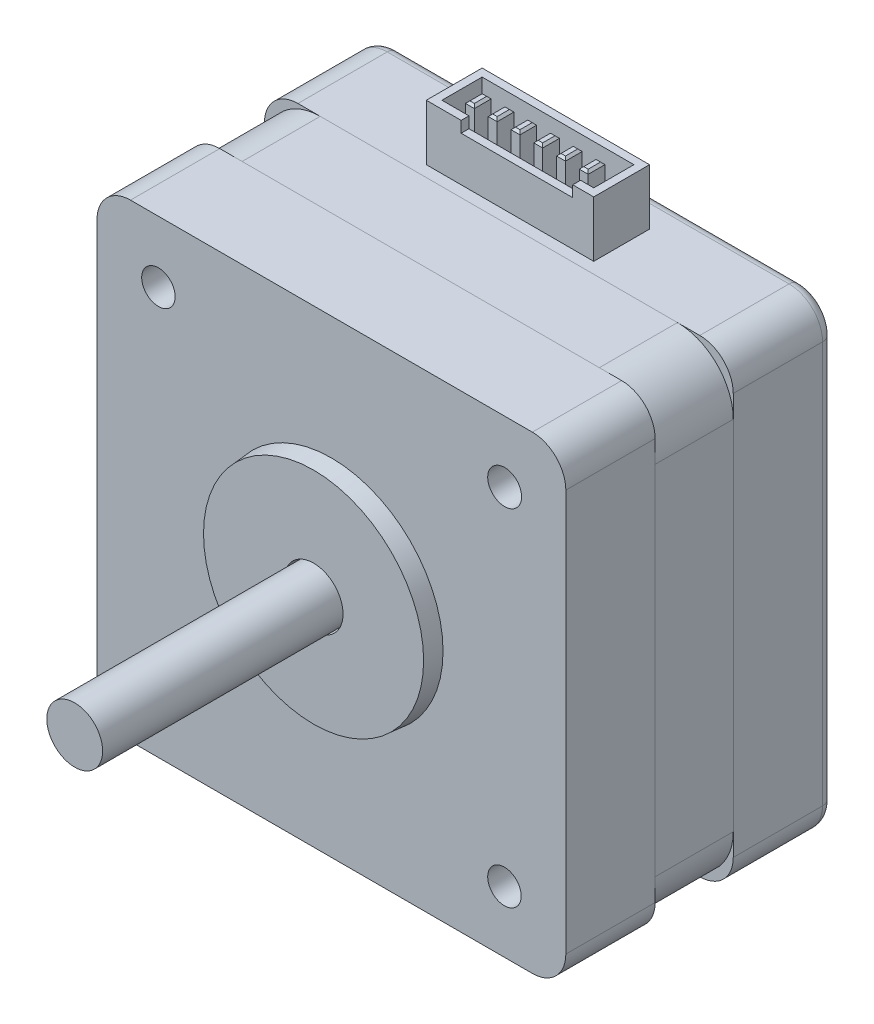
from build123d import *

# Parameters (mm, degrees)
SKETCH_1_R          = 1.5
EXTRUDE_1_DEPTH     = 8
SKETCH_4_R          = 2.5
EXTRUDE_2_DEPTH     = 23
SKETCH_9_W          = 42
SKETCH_9_H          = 42
EXTRUDE_7_DEPTH     = 7
SKETCH_10_W         = 42
SKETCH_10_H         = 42
EXTRUDE_8_DEPTH     = 9
FILLET_1_R          = 3
FILLET_2_R          = 5
SKETCH_12_R         = 1.5
SKETCH_12_R_2       = 1.518540069
CUT_EXTRUDE_1_DEPTH = 39.183766184
SKETCH_14_W         = 15
SKETCH_14_H         = 5
SKETCH_14_W_2       = 13.6
SKETCH_14_H_2       = 3.6
SKETCH_14_W_3       = 0.8
SKETCH_14_H_3       = 1.5
EXTRUDE_10_DEPTH    = 5
CHAMFER_1_SIZE      = 0.2
SKETCH_15_W         = 10
SKETCH_15_H         = 1
CUT_EXTRUDE_2_DEPTH = 0.7
FILLET_3_R          = 1
SKETCH_16_R         = 10
SKETCH_16_R_2       = 2.5
EXTRUDE_11_DEPTH    = 1.6
EXTRUDE_11_DRAFT    = 5
SKETCH_18_R         = 5
CUT_EXTRUDE_3_DEPTH = 3
EXTRUDE_START       = 2
SKETCH_19_R         = 2.5
EXTRUDE_13_DEPTH    = 2


with BuildPart() as part:
    # 草图1 → 凸台-拉伸1 (new body)
    with BuildSketch(Plane.XY):
        with BuildLine():
            Line((-18, 21), (18, 21))
            ThreePointArc((18, 21), (20.121320344, 20.121320344), (21, 18))
            Line((21, 18), (21, -18))
            ThreePointArc((21, -18), (20.121320344, -20.121320344), (18, -21))
            Line((18, -21), (-18, -21))
            ThreePointArc((-18, -21), (-20.121320344, -20.121320344), (-21, -18))
            Line((-21, -18), (-21, 18))
            ThreePointArc((-21, 18), (-20.121320344, 20.121320344), (-18, 21))
        make_face()
        with Locations((-15.5, 15.5)):
            Circle(SKETCH_1_R, mode=Mode.SUBTRACT)
        with Locations(Location((15.5, 15.5, 0), (0, 0, 180))):
            Circle(SKETCH_1_R, mode=Mode.SUBTRACT)
        with Locations((15.5, -15.5)):
            Circle(SKETCH_1_R, mode=Mode.SUBTRACT)
        with Locations(Location((-15.5, -15.5, 0), (0, 0, 180))):
            Circle(SKETCH_1_R, mode=Mode.SUBTRACT)
    extrude(amount=EXTRUDE_1_DEPTH)

    # 草图4 → 凸台-拉伸2 (add)
    with BuildSketch(Plane.XY.offset(8)):
        with Locations(Location((0, 0, 0), (0, 0, 180))):
            Circle(SKETCH_4_R)
    extrude(amount=EXTRUDE_2_DEPTH)


with BuildPart() as body_2:
    # 草图9 → 凸台-拉伸7 (new body)
    with BuildSketch(Plane(origin=(0, 0, 0), x_dir=(-1, 0, 0), z_dir=(0, 0, -1))):
        Rectangle(SKETCH_9_W, SKETCH_9_H)
    extrude(amount=EXTRUDE_7_DEPTH)

    # 圆角2
    fillet_2_edges = [body_2.edges().sort_by_distance(p)[0] for p in [
        (-21, -21, -3.5),
        (21, -21, -3.5),
        (21, 21, -3.5),
        (-21, 21, -3.5),
    ]]
    fillet(fillet_2_edges, radius=FILLET_2_R)


with BuildPart() as body_3:
    # 草图10 → 凸台-拉伸8 (new body)
    with BuildSketch(Plane(origin=(0, 0, -7), x_dir=(-1, 0, 0), z_dir=(0, 0, -1))):
        Rectangle(SKETCH_10_W, SKETCH_10_H)
    extrude(amount=EXTRUDE_8_DEPTH)

    # 圆角1
    fillet_1_edges = [body_3.edges().sort_by_distance(p)[0] for p in [
        (21, 21, -11.5),
        (-21, 21, -11.5),
        (-21, -21, -11.5),
        (21, -21, -11.5),
    ]]
    fillet(fillet_1_edges, radius=FILLET_1_R)


with BuildPart() as cut_extrude_1_tool:
    # 草图12 → 切除-拉伸1 (new, through all)
    with BuildSketch(Plane.XY.offset(8)):
        with Locations((-15.5, 15.5)):
            Circle(SKETCH_12_R)
        with Locations((15.518540069, 15.5)):
            Circle(SKETCH_12_R_2)
        with Locations((-15.5, -15.5)):
            Circle(SKETCH_12_R)
        with Locations((15.5, -15.5)):
            Circle(SKETCH_12_R)
    extrude(amount=-CUT_EXTRUDE_1_DEPTH)


with BuildPart() as part_1:
    add(part.part)

    # 切除-拉伸1: cut by cut_extrude_1_tool
    add(cut_extrude_1_tool.part, mode=Mode.SUBTRACT)


with BuildPart() as body_2_1:
    add(body_2.part)

    # 切除-拉伸1: cut by cut_extrude_1_tool
    add(cut_extrude_1_tool.part, mode=Mode.SUBTRACT)


with BuildPart() as body_3_1:
    add(body_3.part)

    # 切除-拉伸1: cut by cut_extrude_1_tool
    add(cut_extrude_1_tool.part, mode=Mode.SUBTRACT)

    # 草图14 → 凸台-拉伸10 (add)
    # profile 1 of 7: a face of its own
    with BuildSketch(Plane(origin=(0, 21, 0), x_dir=(1, 0, 0), z_dir=(0, 1, 0))):
        with Locations((0, 10.5)):
            Rectangle(SKETCH_14_W, SKETCH_14_H)
        with Locations((0, 10.5)):
            Rectangle(SKETCH_14_W_2, SKETCH_14_H_2, mode=Mode.SUBTRACT)
    # profile 2 of 7: a face of its own
    with BuildSketch(Plane(origin=(0, 21, 0), x_dir=(1, 0, 0), z_dir=(0, 1, 0))):
        with Locations((-5.3, 10.457329348)):
            Rectangle(SKETCH_14_W_3, SKETCH_14_H_3)
    # profile 3 of 7: a face of its own
    with BuildSketch(Plane(origin=(0, 21, 0), x_dir=(1, 0, 0), z_dir=(0, 1, 0))):
        with Locations((-1.22, 10.457329348)):
            Rectangle(SKETCH_14_W_3, SKETCH_14_H_3)
    # profile 4 of 7: a face of its own
    with BuildSketch(Plane(origin=(0, 21, 0), x_dir=(1, 0, 0), z_dir=(0, 1, 0))):
        with Locations((4.9, 10.457329348)):
            Rectangle(SKETCH_14_W_3, SKETCH_14_H_3)
    # profile 5 of 7: a face of its own
    with BuildSketch(Plane(origin=(0, 21, 0), x_dir=(1, 0, 0), z_dir=(0, 1, 0))):
        with Locations((2.86, 10.457329348)):
            Rectangle(SKETCH_14_W_3, SKETCH_14_H_3)
    # profile 6 of 7: a face of its own
    with BuildSketch(Plane(origin=(0, 21, 0), x_dir=(1, 0, 0), z_dir=(0, 1, 0))):
        with Locations((-3.26, 10.457329348)):
            Rectangle(SKETCH_14_W_3, SKETCH_14_H_3)
    # profile 7 of 7: a face of its own
    with BuildSketch(Plane(origin=(0, 21, 0), x_dir=(1, 0, 0), z_dir=(0, 1, 0))):
        with Locations((0.82, 10.457329348)):
            Rectangle(SKETCH_14_W_3, SKETCH_14_H_3)
    extrude(amount=EXTRUDE_10_DEPTH)

    # 倒角1
    chamfer_1_edges = [body_3_1.edges().sort_by_distance(p)[0] for p in [
        (5.3, 26, -10.457329348),
        (4.9, 26, -11.207329348),
        (4.5, 26, -10.457329348),
        (4.9, 26, -9.707329348),
        (3.26, 26, -10.457329348),
        (2.86, 26, -11.207329348),
        (2.46, 26, -10.457329348),
        (2.86, 26, -9.707329348),
        (-2.86, 26, -10.457329348),
        (-3.26, 26, -11.207329348),
        (-3.66, 26, -10.457329348),
        (-3.26, 26, -9.707329348),
        (1.22, 26, -10.457329348),
        (0.82, 26, -11.207329348),
        (0.42, 26, -10.457329348),
        (0.82, 26, -9.707329348),
        (-4.9, 26, -10.457329348),
        (-5.3, 26, -11.207329348),
        (-5.7, 26, -10.457329348),
        (-5.3, 26, -9.707329348),
        (-0.82, 26, -10.457329348),
        (-1.22, 26, -11.207329348),
        (-1.62, 26, -10.457329348),
        (-1.22, 26, -9.707329348),
    ]]
    chamfer(chamfer_1_edges, length=CHAMFER_1_SIZE)

    # 草图15 → 切除-拉伸2 (cut)
    with BuildSketch(Plane.XY.offset(-8)):
        with Locations((0.62, 25.5)):
            Rectangle(SKETCH_15_W, SKETCH_15_H)
    extrude(amount=-CUT_EXTRUDE_2_DEPTH, mode=Mode.SUBTRACT)

    # 圆角3
    fillet_3_edges = [body_3_1.edges().sort_by_distance(p)[0] for p in [
        (0, -21, -16),
        (21, 0, -16),
        (-21, 0, -16),
        (0, 21, -16),
        (20.121320344, 20.121320344, -16),
        (-20.121320344, 20.121320344, -16),
        (-20.121320344, -20.121320344, -16),
        (20.121320344, -20.121320344, -16),
    ]]
    fillet(fillet_3_edges, radius=FILLET_3_R)

    # 草图18 → 切除-拉伸3 (cut)
    with BuildSketch(Plane(origin=(0, 0, -16), x_dir=(-1, 0, 0), z_dir=(0, 0, -1))):
        Circle(SKETCH_18_R)
    extrude(amount=-CUT_EXTRUDE_3_DEPTH, mode=Mode.SUBTRACT)

    # 草图19 → 凸台-拉伸13 (add)
    with BuildSketch(Plane(origin=(0, 0, -13), x_dir=(-1, 0, 0), z_dir=(0, 0, -1)).offset(EXTRUDE_START)):
        Circle(SKETCH_19_R)
    extrude(amount=-EXTRUDE_13_DEPTH)


with BuildPart() as extrude_11_tool:
    # 草图16 → 凸台-拉伸11 (with draft: the straight prism first)
    with BuildSketch(Plane.XY.offset(8)):
        Circle(SKETCH_16_R)
        Circle(SKETCH_16_R_2, mode=Mode.SUBTRACT)
    extrude(amount=EXTRUDE_11_DEPTH)
    # 凸台-拉伸11: the draft: its side faces are tilted about the plane it starts from
    extrude_11_sides = [extrude_11_tool.faces().sort_by_distance(p)[0] for p in [
        (-10, 0, 8.8),
        (-2.5, 0, 8.8),
    ]]
    draft(extrude_11_sides, Plane.XY.offset(8), EXTRUDE_11_DRAFT)


with BuildPart() as part_2:
    add(part_1.part)

    # 凸台-拉伸11: add extrude_11_tool
    add(extrude_11_tool.part)


solid = Compound([body_2_1.part, body_3_1.part, part_2.part])
